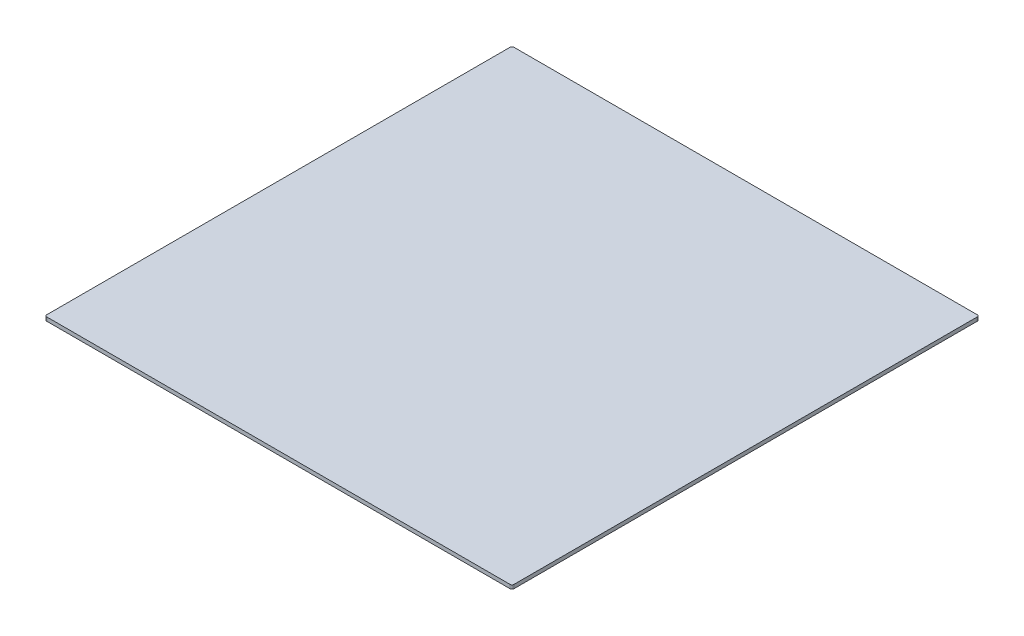
from build123d import *

# Parameters (mm, degrees)
SKETCH1_W           = 247
SKETCH1_H           = 247
BOSS_EXTRUDE1_DEPTH = 1
FILLET1_R           = 1


with BuildPart() as part:
    # Sketch1 → Boss-Extrude1 (new, symmetric)
    with BuildSketch(Plane(origin=(0, 0, 0), x_dir=(1, 0, 0), z_dir=(0, 1, 0))):
        Rectangle(SKETCH1_W, SKETCH1_H)
    extrude(amount=BOSS_EXTRUDE1_DEPTH, both=True)

    # Fillet1
    fillet1_edges = [part.edges().sort_by_distance(p)[0] for p in [
        (123.5, 0, 123.5),
        (-123.5, 0, 123.5),
        (-123.5, 0, -123.5),
        (123.5, 0, -123.5),
    ]]
    fillet(fillet1_edges, radius=FILLET1_R)


solid = part.part
